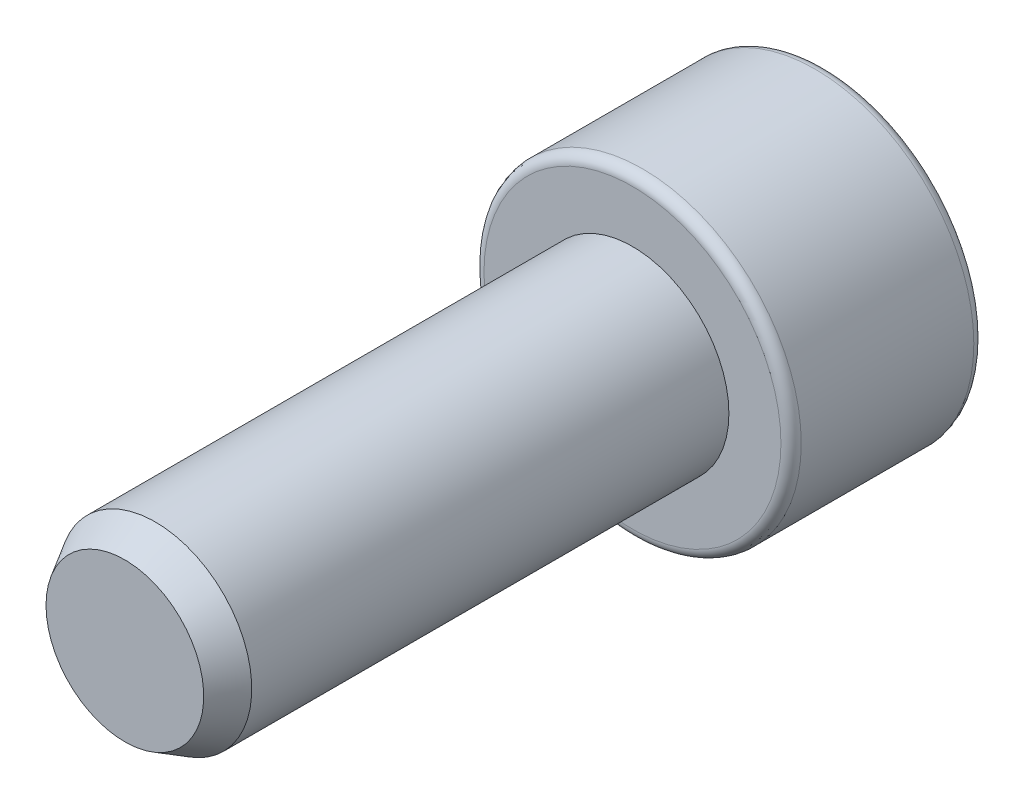
from build123d import *

# Parameters (mm, degrees)
CUT_EXTRUDE1_DEPTH  = 2.54
SKETCH3_R           = 2.413
BOSS_EXTRUDE1_DEPTH = 12.7
CHAMFER1_SIZE       = 0.762
CHAMFER1_SIZE2      = 0.439940905


with BuildPart() as part:
    # Sketch1 → Revolve1 (revolve)
    with BuildSketch(Plane(origin=(0, 0, 0), x_dir=(1, 0, 0), z_dir=(0, 1, 0))):
        with BuildLine():
            Line((0, 0), (3.71475, 0))
            ThreePointArc((3.71475, 0), (3.894355122, -0.074394878), (3.96875, -0.254))
            Line((3.96875, -0.254), (3.96875, -4.572))
            ThreePointArc((3.96875, -4.572), (3.894355122, -4.751605122), (3.71475, -4.826))
            Line((3.71475, -4.826), (0, -4.826))
            Line((0, -4.826), (0, 0))
        make_face()
    revolve(axis=Axis((0, 0, 0), (0, 0, -1)))

    # Sketch2 → Cut-Extrude1 (cut)
    with BuildSketch(Plane(origin=(0, 0, 0), x_dir=(-1, 0, 0), z_dir=(0, 0, -1))):
        Polygon((0, 2.291358881), (-1.984375, 1.14567944), (-1.984375, -1.14567944), (0, -2.291358881), (1.984375, -1.14567944), (1.984375, 1.14567944), align=None)
    extrude(amount=-CUT_EXTRUDE1_DEPTH, mode=Mode.SUBTRACT)

    # Sketch3 → Boss-Extrude1 (add)
    with BuildSketch(Plane.XY.offset(4.826)):
        Circle(SKETCH3_R)
    extrude(amount=BOSS_EXTRUDE1_DEPTH)

    # Chamfer1
    chamfer1_edges = [part.edges().sort_by_distance(p)[0] for p in [
        (-2.413, 0, 17.526),
    ]]
    chamfer1_side = [part.faces().sort_by_distance(p)[0] for p in [
        (-2.413, 0, 11.176),
    ]]
    chamfer(chamfer1_edges, length=CHAMFER1_SIZE, length2=CHAMFER1_SIZE2, reference=chamfer1_side[0])


solid = part.part
